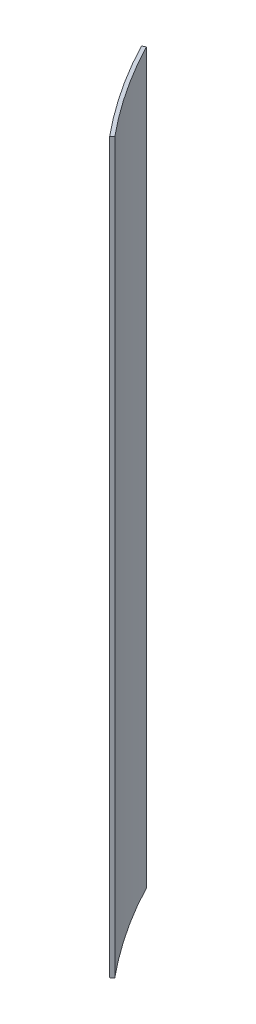
from build123d import *

# Parameters (mm, degrees)
EXTRUDE_3_DEPTH     = 2000
CUT_EXTRUDE_1_DEPTH = 30


with BuildPart() as part:
    # 草图1 → 凸台-拉伸3 (new body)
    with BuildSketch(Plane(origin=(0, 0, 0), x_dir=(1, 0, 0), z_dir=(0, 1, 0))):
        with BuildLine():
            Line((-1145.538694667, -944.968834947), (-1137.824629383, -938.605408449))
            ThreePointArc((-1137.824629383, -938.605408449), (-1229.702487971, -814.528569836), (-1308.107468768, -681.527585761))
            Line((-1308.107468768, -681.527585761), (-1316.97599398, -686.148111766))
            ThreePointArc((-1316.97599398, -686.148111766), (-1238.039453991, -820.050797428), (-1145.538694667, -944.968834947))
        make_face()
    extrude(amount=EXTRUDE_3_DEPTH)

    # 草图2 → 切除-拉伸1 (cut)
    with BuildSketch(Plane(origin=(0, 0, 0), x_dir=(1, 0, 0), z_dir=(0, 1, 0))):
        with BuildLine():
            Line((-1303.208186932, -699.349284345), (-1304.970469808, -700.294989936))
            ThreePointArc((-1304.970469808, -700.294989936), (-1301.285862357, -707.118168647), (-1297.565579497, -713.921961355))
            Line((-1297.565579497, -713.921961355), (-1295.813296472, -712.957853373))
            ThreePointArc((-1295.813296472, -712.957853373), (-1299.528555318, -706.16324877), (-1303.208186932, -699.349284345))
        make_face()
    extrude(amount=CUT_EXTRUDE_1_DEPTH, mode=Mode.SUBTRACT)


solid = part.part
